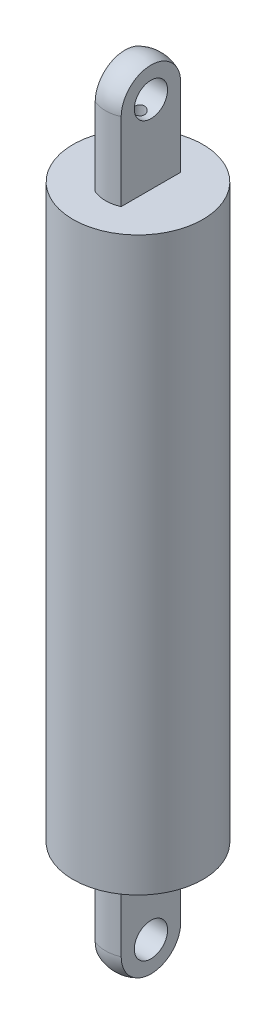
from build123d import *

# Parameters (mm, degrees)
CUT_EXTRUDE2_DEPTH = 68.277043819
SKETCH4_R          = 1.627
CUT_EXTRUDE3_DEPTH = 40.984836188


with BuildPart() as part:
    # Sketch1 → Revolve-Thin1 (revolve)
    with BuildSketch(Plane(origin=(0, 0, 0), x_dir=(0, 0, -1), z_dir=(1, 0, 0))):
        with BuildLine():
            ThreePointArc((0, 38.735), (-2.24506403, 37.80506403), (-3.175, 35.56))
            Line((-3.175, 35.56), (-3.175, 27.94))
            Line((-3.175, 27.94), (-6.35, 27.94))
            Line((-6.35, 27.94), (-6.35, -27.94))
            Line((-6.35, -27.94), (-3.175, -27.94))
            Line((-3.175, -27.94), (-3.175, -35.56))
            ThreePointArc((-3.175, -35.56), (-2.24506403, -37.80506403), (0, -38.735))
            Line((0, -38.735), (0, -36.195))
            ThreePointArc((0, -36.195), (-0.449012806, -36.009012806), (-0.635, -35.56))
            Line((-0.635, -35.56), (-0.635, -25.4))
            Line((-0.635, -25.4), (-3.81, -25.4))
            Line((-3.81, -25.4), (-3.81, 25.4))
            Line((-3.81, 25.4), (-0.635, 25.4))
            Line((-0.635, 25.4), (-0.635, 35.56))
            ThreePointArc((-0.635, 35.56), (-0.449012806, 36.009012806), (0, 36.195))
            Line((0, 36.195), (0, 38.735))
        make_face()
    revolve(axis=Axis((0, 35.56, 0), (0, -1, 0)))

    # Sketch3 → Cut-Extrude2 (cut, through all)
    with BuildSketch(Plane(origin=(0, 27.94, 0), x_dir=(1, 0, 0), z_dir=(0, 1, 0))):
        with BuildLine():
            ThreePointArc((-1.27, 2.909935566), (-3.175, 0), (-1.27, -2.909935566))
            Line((-1.27, -2.909935566), (-1.27, 2.909935566))
        make_face()
        with BuildLine():
            Line((1.27, 2.909935566), (1.27, -2.909935566))
            ThreePointArc((1.27, -2.909935566), (2.656395584, -1.73901912), (3.175, 0))
            ThreePointArc((3.175, 0), (2.656395584, 1.73901912), (1.27, 2.909935566))
        make_face()
    cut_extrude2 = extrude(amount=CUT_EXTRUDE2_DEPTH, mode=Mode.SUBTRACT)

    # Mirror1: Cut-Extrude2 across plane
    add(cut_extrude2.mirror(Plane.ZX), mode=Mode.SUBTRACT)

    # Sketch4 → Cut-Extrude3 (cut, through all)
    with BuildSketch(Plane(origin=(1.27, 0, 0), x_dir=(0, 0, -1), z_dir=(1, 0, 0))):
        with Locations((0, 35.56)):
            Circle(SKETCH4_R)
        with Locations((0, -35.56)):
            Circle(SKETCH4_R)
    extrude(amount=-CUT_EXTRUDE3_DEPTH, mode=Mode.SUBTRACT)


solid = part.part
